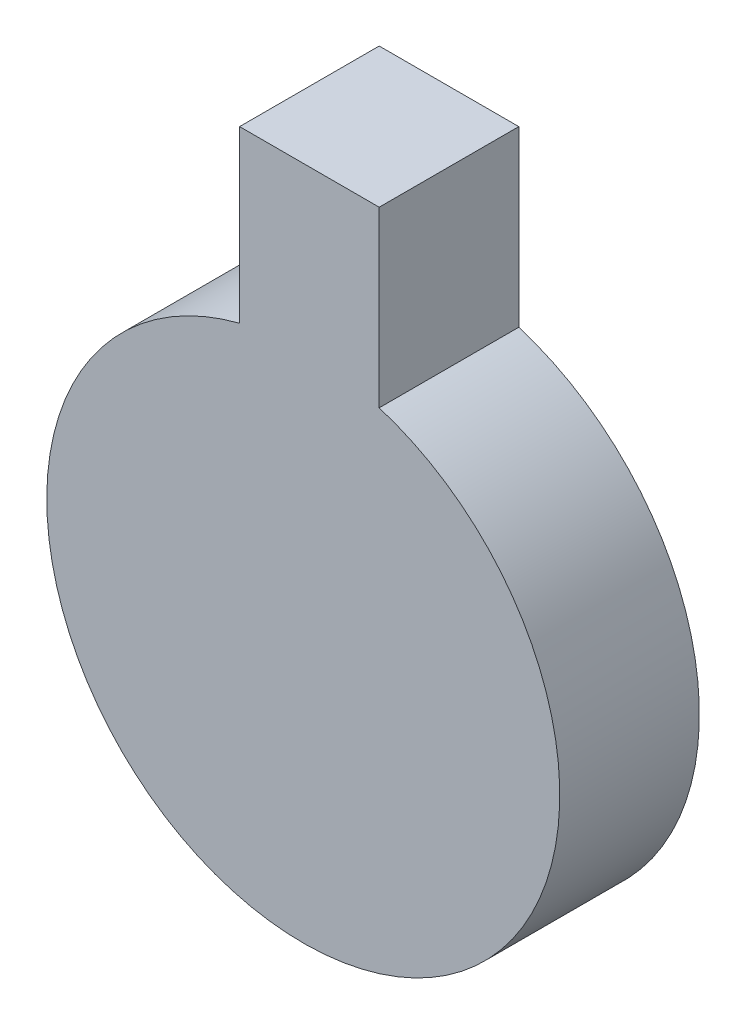
from build123d import *

# Parameters (mm, degrees)
SKETCH1_R           = 0.0735
BOSS_EXTRUDE1_DEPTH = 0.04
SKETCH2_W           = 0.04
SKETCH2_H           = 0.04
BOSS_EXTRUDE2_DEPTH = 0.12


with BuildPart() as part:
    # Sketch1 → Boss-Extrude1 (new body)
    with BuildSketch(Plane.XY):
        Circle(SKETCH1_R)
    extrude(amount=BOSS_EXTRUDE1_DEPTH)

    # Sketch2 → Boss-Extrude2 (add)
    with BuildSketch(Plane(origin=(0, 0, 0), x_dir=(1, 0, 0), z_dir=(0, 1, 0))):
        with Locations((0.001756404, -0.019999999)):
            Rectangle(SKETCH2_W, SKETCH2_H)
    extrude(amount=BOSS_EXTRUDE2_DEPTH)


solid = part.part
